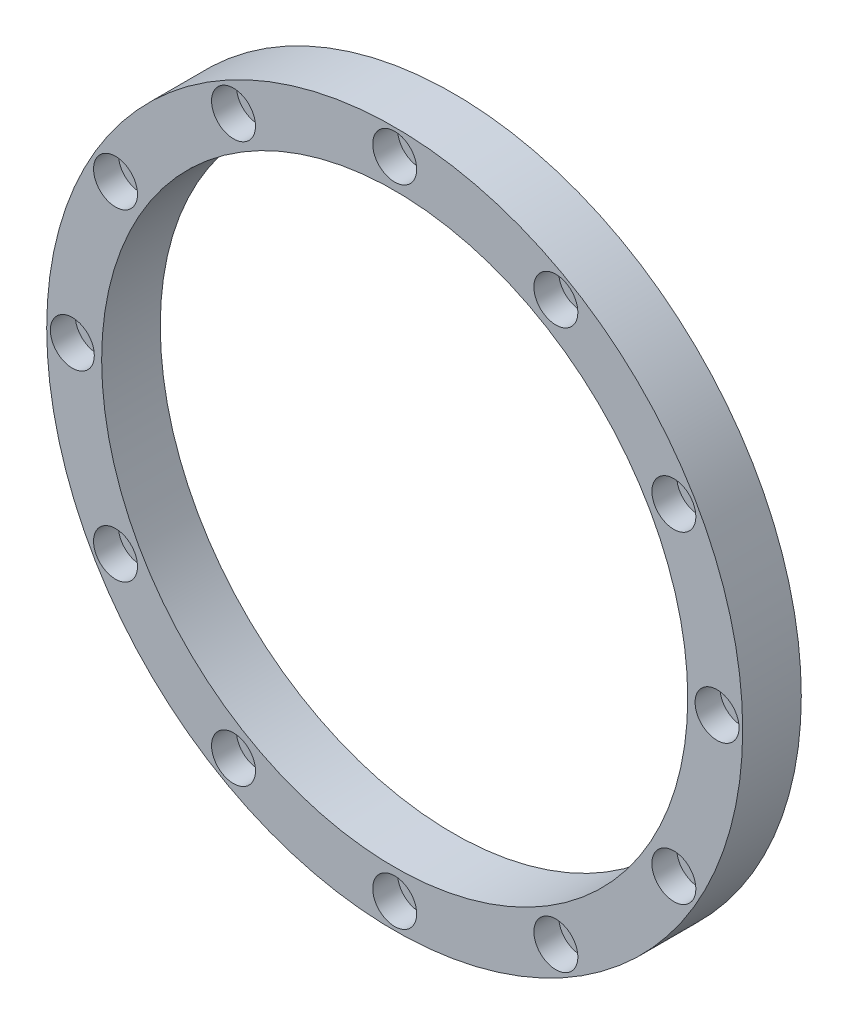
from build123d import *

# Parameters (mm, degrees)
SKETCH_1_R                = 47.5
EXTRUDE_1_DEPTH           = 8
HOLE_WIZARD_1_D           = 3.4
HOLE_WIZARD_1_CBORE_D     = 6
HOLE_WIZARD_1_CBORE_DEPTH = 3.4
SKETCH_4_R                = 40
CUT_EXTRUDE_1_DEPTH       = 68.649833703
PATTERN_CIRCULAR_1_COUNT  = 12


with BuildPart() as part:
    # 草图1 → 凸台-拉伸1 (new body)
    with BuildSketch(Plane.XY):
        Circle(SKETCH_1_R)
    extrude(amount=EXTRUDE_1_DEPTH)

    # 打孔尺寸(%根据)内六角圆柱头螺钉的类型1 (through all)
    with Locations(Plane.XY.offset(8)):
        with Locations((0, 44)):
            hole_wizard_1 = CounterBoreHole(HOLE_WIZARD_1_D / 2, HOLE_WIZARD_1_CBORE_D / 2, HOLE_WIZARD_1_CBORE_DEPTH)

    # 草图4 → 切除-拉伸1 (cut, through all)
    with BuildSketch(Plane.XY.offset(8)):
        Circle(SKETCH_4_R)
    extrude(amount=-CUT_EXTRUDE_1_DEPTH, mode=Mode.SUBTRACT)

    # 阵列(圆周)1: 打孔尺寸(%根据)内六角圆柱头螺钉的类型1 ×12 about axis
    pattern_circular_1_axis = Axis((0, 0, 8), (0, 0, -1))
    for i in range(1, PATTERN_CIRCULAR_1_COUNT):
        add(hole_wizard_1.rotate(pattern_circular_1_axis, i * 360 / PATTERN_CIRCULAR_1_COUNT), mode=Mode.SUBTRACT)


solid = part.part
